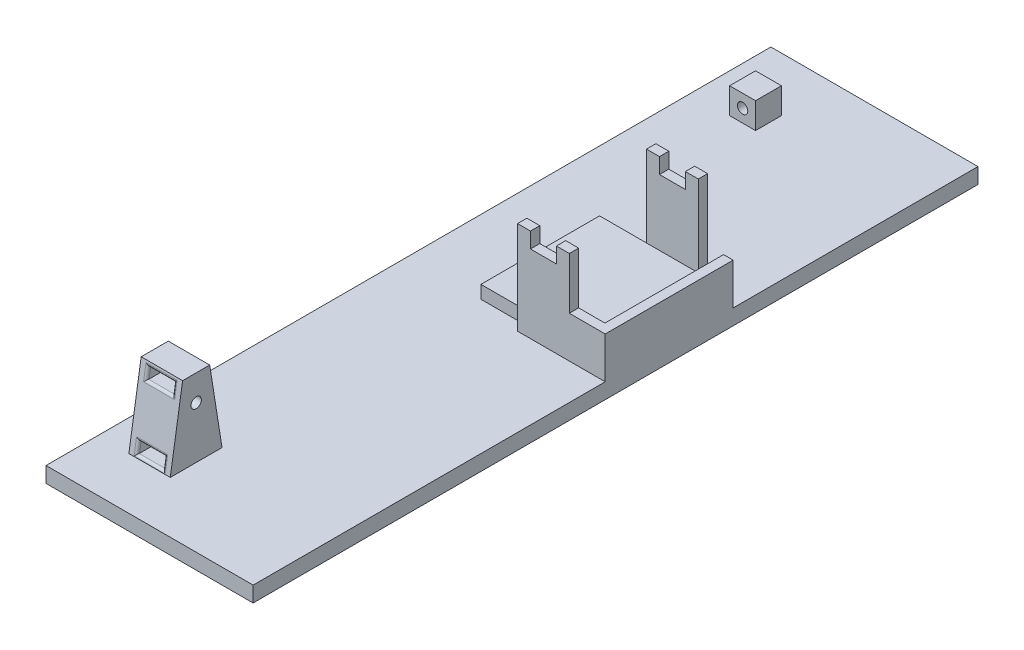
from build123d import *

# Parameters (mm, degrees)
TEST_MOUNT_SKETCH_R                  = 1
TEST_MOUNT_EXTRUDE_DEPTH             = 4
MOUTNING_PLATE_SKETCH_W              = 40
MOUTNING_PLATE_SKETCH_H              = 140
MOUNTING_PLATE_EXTRUDE_DEPTH         = 3
SERVO_MOUNT_SKETCH_W                 = 10
SERVO_MOUNT_SKETCH_H                 = 1.8
MOUNTING_SERVO_EXTRUDE_DEPTH         = 8
SERVO_FLOOR_SKETCH_W                 = 23.95
SERVO_FLOOR_SKETCH_H                 = 22.91
SERVO_FLOOR_EXTRUDE_DEPTH            = 2.5
ROUTING_HOLES_SKETCH_W               = 5
ROUTING_HOLES_SKETCH_H               = 2
ROUTING_HOLES_EXTRUDED_CUT_DEPTH     = 10
ROUTING_FILLETS_R                    = 0.5
TIE_OFF_BASE_W                       = 5
TIE_OFF_BASE_H                       = 5
TIE_OFF_BASE_EXTRUDE_DEPTH           = 5
TIE_OFF_BASE_HOLE_SKETCH_R           = 1
TIE_OFF_BASE_HOLE_EXTRUDED_CUT_DEPTH = 5
SERVO_HOLD_SKETCH_W                  = 10
SERVO_HOLD_SKETCH_H                  = 1.8
SERVO_HOLD_EXTRUDE_DEPTH             = 10
SERVO_HOLDER_CUT_OUT_SKETCH_W        = 5
SERVO_HOLDER_CUT_OUT_SKETCH_H        = 1.8
SERVO_HOLDER_CUT_OUT_CUT_DEPTH       = 3


with BuildPart() as part:
    # Test Mount Sketch → Test Mount Extrude (new, symmetric)
    with BuildSketch(Plane(origin=(0, 0, 0), x_dir=(0, 0, -1), z_dir=(1, 0, 0))):
        Polygon((-5, 0), (-2.616302657, 15), (2.616302657, 15), (5, 0), align=None)
        with Locations((0, 10)):
            Circle(TEST_MOUNT_SKETCH_R, mode=Mode.SUBTRACT)
    extrude(amount=TEST_MOUNT_EXTRUDE_DEPTH, both=True)

    # Moutning Plate Sketch → Mounting Plate Extrude (add)
    with BuildSketch(Plane(origin=(0, 0, 0), x_dir=(1, 0, 0), z_dir=(0, 1, 0))):
        with Locations((10, 55)):
            Rectangle(MOUTNING_PLATE_SKETCH_W, MOUTNING_PLATE_SKETCH_H)
    extrude(amount=-MOUNTING_PLATE_EXTRUDE_DEPTH)

    # Servo Mount Sketch → Mounting Servo Extrude (add)
    with BuildSketch(Plane(origin=(0, 0, 0), x_dir=(1, 0, 0), z_dir=(0, 1, 0))):
        Polygon((30, 77.71), (28.15, 77.71), (28.15, 54.8), (13.07, 54.8), (13.07, 53), (30, 53), align=None)
        with Locations((18.07, 78.81)):
            Rectangle(SERVO_MOUNT_SKETCH_W, SERVO_MOUNT_SKETCH_H)
    extrude(amount=MOUNTING_SERVO_EXTRUDE_DEPTH)

    # Servo Floor Sketch → Servo Floor Extrude (add)
    with BuildSketch(Plane(origin=(0, 0, 0), x_dir=(1, 0, 0), z_dir=(0, 1, 0))):
        with Locations((16.175, 66.255)):
            Rectangle(SERVO_FLOOR_SKETCH_W, SERVO_FLOOR_SKETCH_H)
    extrude(amount=SERVO_FLOOR_EXTRUDE_DEPTH)

    # Routing Holes Sketch → Routing Holes Extruded Cut (cut)
    with BuildSketch(Plane.XY.offset(5)):
        with Locations((0, 13)):
            Rectangle(ROUTING_HOLES_SKETCH_W, ROUTING_HOLES_SKETCH_H)
        with Locations((0, 1.5)):
            Rectangle(ROUTING_HOLES_SKETCH_W, ROUTING_HOLES_SKETCH_H)
    extrude(amount=-ROUTING_HOLES_EXTRUDED_CUT_DEPTH, mode=Mode.SUBTRACT)

    # Routing Fillets
    routing_fillets_edges = [part.edges().sort_by_distance(p)[0] for p in [
        (-2.5, 1.5, -4.761630266),
        (0, 2.5, -4.602717109),
        (2.5, 1.5, -4.761630266),
        (0, 0.5, -4.920543422),
        (0, 0.5, 4.920543422),
        (2.5, 1.5, 4.761630266),
        (0, 2.5, 4.602717109),
        (-2.5, 1.5, 4.761630266),
        (0, 12, 3.093042125),
        (2.5, 13, 2.934128969),
        (0, 14, 2.775215813),
        (-2.5, 13, 2.934128969),
        (-2.5, 13, -2.934128969),
        (0, 14, -2.775215813),
        (2.5, 13, -2.934128969),
        (0, 12, -3.093042125),
    ]]
    fillet(routing_fillets_edges, radius=ROUTING_FILLETS_R)

    # Tie Off Base → Tie Off Base Extrude (add)
    with BuildSketch(Plane(origin=(0, 0, 0), x_dir=(1, 0, 0), z_dir=(0, 1, 0))):
        with Locations((0, 112.034286595)):
            Rectangle(TIE_OFF_BASE_W, TIE_OFF_BASE_H)
    extrude(amount=TIE_OFF_BASE_EXTRUDE_DEPTH)

    # Tie Off Base Hole Sketch → Tie Off Base Hole Extruded Cut (cut)
    with BuildSketch(Plane(origin=(0, 0, -114.534286595), x_dir=(-1, 0, 0), z_dir=(0, 0, -1))):
        with Locations((0, 2.5)):
            Circle(TIE_OFF_BASE_HOLE_SKETCH_R)
    extrude(amount=-TIE_OFF_BASE_HOLE_EXTRUDED_CUT_DEPTH, mode=Mode.SUBTRACT)

    # Servo Hold Sketch → Servo Hold Extrude (add)
    with BuildSketch(Plane(origin=(0, 8, 0), x_dir=(1, 0, 0), z_dir=(0, 1, 0))):
        with Locations((18.07, 78.81)):
            Rectangle(SERVO_HOLD_SKETCH_W, SERVO_HOLD_SKETCH_H)
        with Locations((18.07, 53.9)):
            Rectangle(SERVO_HOLD_SKETCH_W, SERVO_HOLD_SKETCH_H)
    extrude(amount=SERVO_HOLD_EXTRUDE_DEPTH)

    # Servo Holder Cut Out Sketch → Servo Holder Cut out Cut (cut)
    with BuildSketch(Plane(origin=(0, 18, 0), x_dir=(1, 0, 0), z_dir=(0, 1, 0))):
        with Locations((18.07, 78.81)):
            Rectangle(SERVO_HOLDER_CUT_OUT_SKETCH_W, SERVO_HOLDER_CUT_OUT_SKETCH_H)
        with Locations((18.07, 53.9)):
            Rectangle(SERVO_HOLDER_CUT_OUT_SKETCH_W, SERVO_HOLDER_CUT_OUT_SKETCH_H)
    extrude(amount=-SERVO_HOLDER_CUT_OUT_CUT_DEPTH, mode=Mode.SUBTRACT)


solid = part.part
